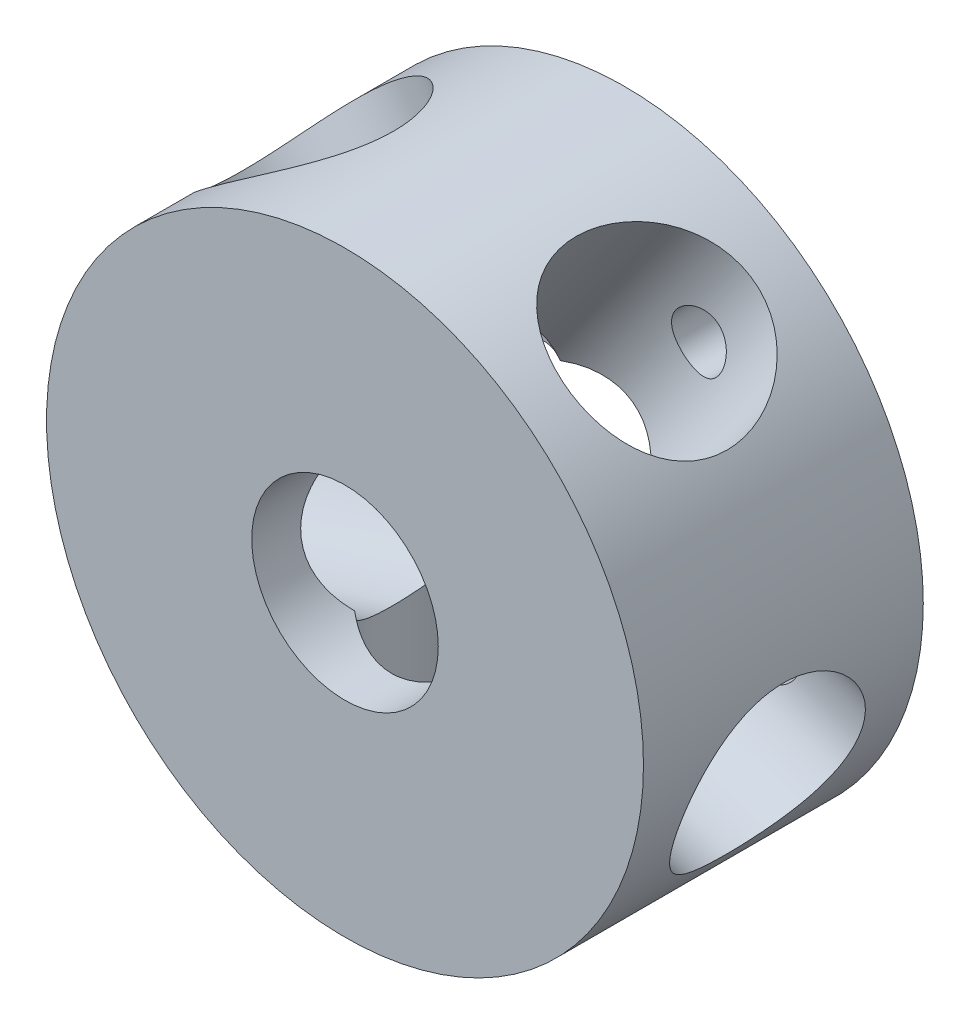
from build123d import *

# Parameters (mm, degrees)
SKETCH1_R           = 32
SKETCH1_R_2         = 10
BOSS_EXTRUDE1_DEPTH = 15
SKETCH2_R           = 10
CUT_EXTRUDE1_DEPTH  = 48.675989764
CIRPATTERN1_COUNT   = 5
SKETCH4_R           = 3
CUT_EXTRUDE3_DEPTH  = 11
CIRPATTERN2_COUNT   = 5


with BuildPart() as part:
    # Sketch1 → Boss-Extrude1 (new, symmetric)
    with BuildSketch(Plane.XY):
        Circle(SKETCH1_R)
        Circle(SKETCH1_R_2, mode=Mode.SUBTRACT)
    extrude(amount=BOSS_EXTRUDE1_DEPTH, both=True)

    # Sketch2 → Cut-Extrude1 (cut, through all)
    with BuildSketch(Plane(origin=(0, 0, 0), x_dir=(1, 0, 0), z_dir=(0, 1, 0))):
        with Locations(Location((0, 0, 0), (0, 0, 270))):
            Circle(SKETCH2_R)
    cut_extrude1 = extrude(amount=-CUT_EXTRUDE1_DEPTH, mode=Mode.SUBTRACT)

    # CirPattern1: Cut-Extrude1 ×5 about axis
    cirpattern1_axis = Axis((0, 0, 15), (0, 0, -1))
    for i in range(1, CIRPATTERN1_COUNT):
        add(cut_extrude1.rotate(cirpattern1_axis, i * 360 / CIRPATTERN1_COUNT), mode=Mode.SUBTRACT)

    # Sketch4 → Cut-Extrude3 (cut)
    with BuildSketch(Plane.XY.offset(-15)):
        with Locations(Location((-12.6186816, 18.021344974, 0), (0, 0, 180))):
            Circle(SKETCH4_R)
    cut_extrude3 = extrude(amount=CUT_EXTRUDE3_DEPTH, mode=Mode.SUBTRACT)

    # CirPattern2: Cut-Extrude3 ×5 about axis
    cirpattern2_axis = Axis((0, 0, 0), (0, 0, 1))
    for i in range(1, CIRPATTERN2_COUNT):
        add(cut_extrude3.rotate(cirpattern2_axis, i * 360 / CIRPATTERN2_COUNT), mode=Mode.SUBTRACT)


solid = part.part
